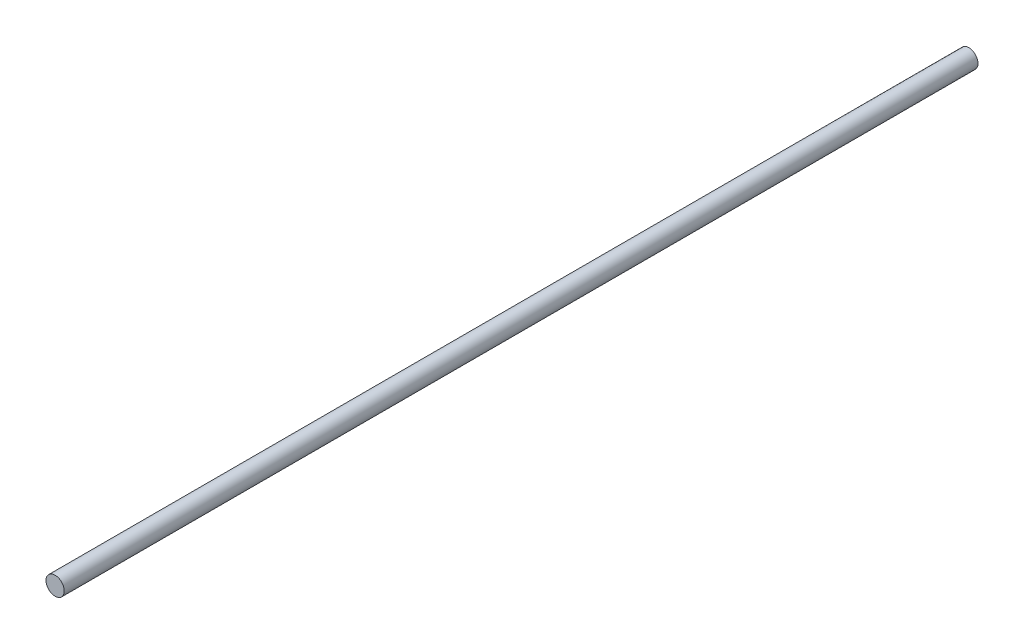
from build123d import *

# Parameters (mm, degrees)
SKETCH1_R           = 4
BOSS_EXTRUDE1_DEPTH = 400


with BuildPart() as part:
    # Sketch1 → Boss-Extrude1 (new body)
    with BuildSketch(Plane.XY):
        with Locations((-64.261600538, 23.212863868)):
            Circle(SKETCH1_R)
    extrude(amount=BOSS_EXTRUDE1_DEPTH)


solid = part.part
